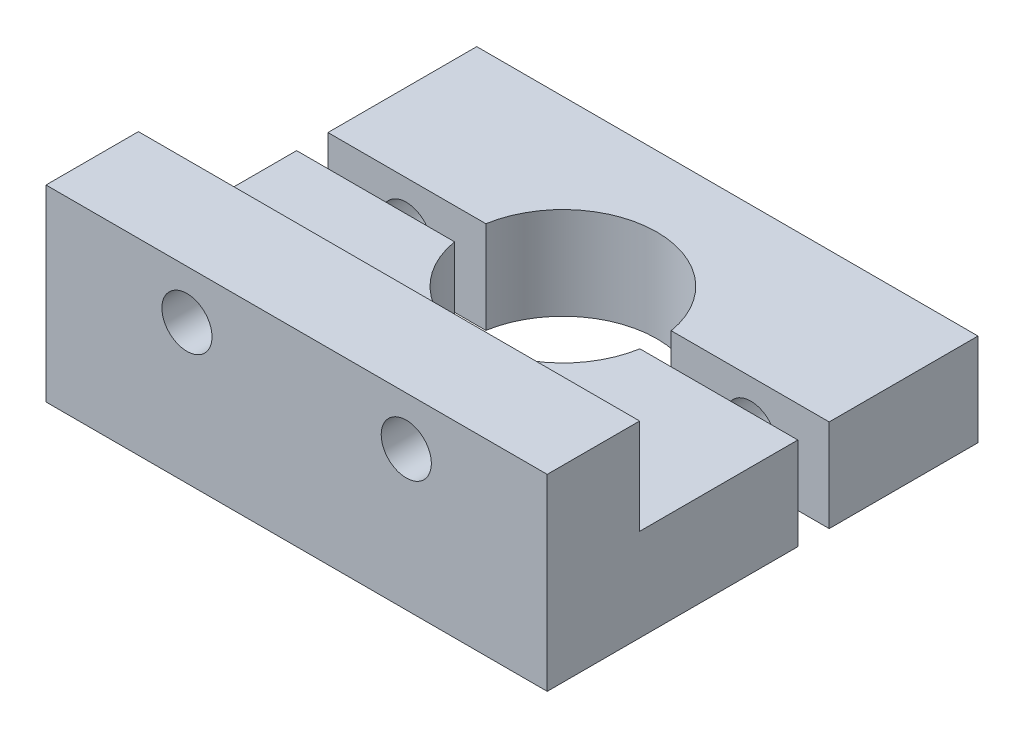
from build123d import *

# Parameters (mm, degrees)
EXTRUDE_1_DEPTH     = 2.95
EXTRUDE_1_2_DEPTH   = 2.95
SKETCH_3_R          = 1.6
CUT_EXTRUDE_1_DEPTH = 17.5
SKETCH_4_W          = 32
SKETCH_4_H          = 5.9
EXTRUDE_2_DEPTH     = 6.1
SKETCH_5_R          = 1.6
CUT_EXTRUDE_2_DEPTH = 6.1


with BuildPart() as part:
    # 草图1 → 凸台-拉伸1 (new, symmetric)
    with BuildSketch(Plane(origin=(0, 0, 0), x_dir=(1, 0, 0), z_dir=(0, 1, 0))):
        with BuildLine():
            Line((-16, 16), (-16, 0))
            Line((-16, 0), (16, 0))
            Line((16, 0), (16, 16))
            Line((16, 16), (5.916079783, 16))
            ThreePointArc((5.916079783, 16), (0, 11), (-5.916079783, 16))
            Line((-5.916079783, 16), (-16, 16))
        make_face()
    extrude(amount=EXTRUDE_1_DEPTH, both=True)


with BuildPart() as body_2:
    # 草图1 → Extrude 1 2 (new, symmetric)
    with BuildSketch(Plane(origin=(0, 0, 0), x_dir=(1, 0, 0), z_dir=(0, 1, 0))):
        with BuildLine():
            Line((-16, 18), (-5.916079783, 18))
            ThreePointArc((-5.916079783, 18), (0, 23), (5.916079783, 18))
            Line((5.916079783, 18), (16.002629356, 18))
            Line((16.002629356, 18), (16.002629356, 27.5))
            Line((16.002629356, 27.5), (-16, 27.5))
            Line((-16, 27.5), (-16, 18))
        make_face()
    extrude(amount=EXTRUDE_1_2_DEPTH, both=True)


with BuildPart() as cut_extrude_1_tool:
    # 草图3 → 切除-拉伸1 (new body)
    with BuildSketch(Plane(origin=(0, 0, -27.5), x_dir=(-1, 0, 0), z_dir=(0, 0, -1))):
        with Locations((-11, 0)):
            Circle(SKETCH_3_R)
        with Locations(Location((11, 0, 0), (0, 0, 180))):
            Circle(SKETCH_3_R)
    extrude(amount=-CUT_EXTRUDE_1_DEPTH)


with BuildPart() as part_1:
    add(part.part)

    # 切除-拉伸1: cut by cut_extrude_1_tool
    add(cut_extrude_1_tool.part, mode=Mode.SUBTRACT)

    # 草图4 → 凸台-拉伸2 (add)
    with BuildSketch(Plane(origin=(0, 2.95, 0), x_dir=(1, 0, 0), z_dir=(0, 1, 0))):
        with Locations((0, 2.95)):
            Rectangle(SKETCH_4_W, SKETCH_4_H)
    extrude(amount=EXTRUDE_2_DEPTH)

    # 草图5 → 切除-拉伸2 (cut)
    with BuildSketch(Plane(origin=(0, 0, -5.9), x_dir=(-1, 0, 0), z_dir=(0, 0, -1))):
        with Locations((-7, 5.95)):
            Circle(SKETCH_5_R)
        with Locations((7, 5.95)):
            Circle(SKETCH_5_R)
    extrude(amount=-CUT_EXTRUDE_2_DEPTH, mode=Mode.SUBTRACT)


with BuildPart() as body_2_1:
    add(body_2.part)

    # 切除-拉伸1: cut by cut_extrude_1_tool
    add(cut_extrude_1_tool.part, mode=Mode.SUBTRACT)


solid = Compound([part_1.part, body_2_1.part])
